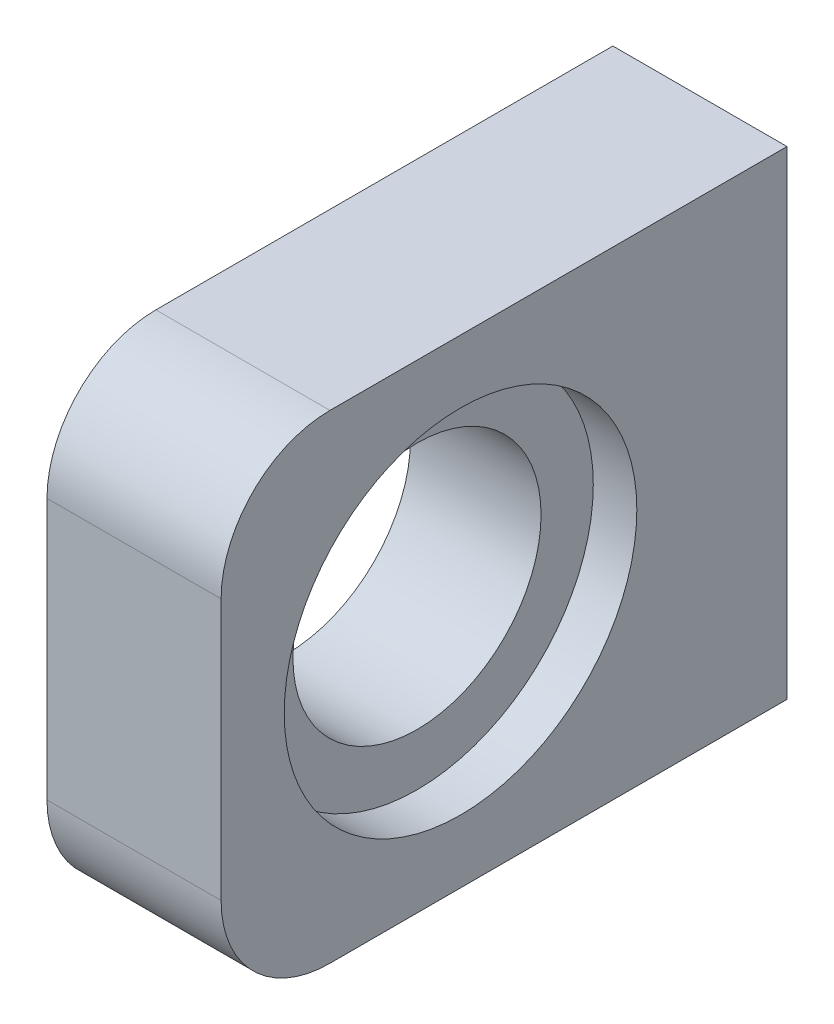
from build123d import *

# Parameters (mm, degrees)
SKETCH1_W                 = 26
SKETCH1_H                 = 22
BOSS_EXTRUDE1_DEPTH       = 8
SKETCH2_R                 = 8.1
CUT_EXTRUDE1_DEPTH        = 2
M4X0_7_TAPPED_HOLE1_D     = 3.3
M4X0_7_TAPPED_HOLE1_DEPTH = 6
M4X0_7_TAPPED_HOLE1_TIP   = 0.991420021
M10_CLEARANCE_HOLE1_D     = 11.4
FILLET1_R                 = 5


with BuildPart() as part:
    # Sketch1 → Boss-Extrude1 (new body)
    with BuildSketch(Plane(origin=(8, 0, 0), x_dir=(0, 0, -1), z_dir=(1, 0, 0))):
        with Locations((-9, 11)):
            Rectangle(SKETCH1_W, SKETCH1_H)
    extrude(amount=-BOSS_EXTRUDE1_DEPTH)

    # Sketch2 → Cut-Extrude1 (cut)
    with BuildSketch(Plane(origin=(8, 0, 0), x_dir=(0, 0, -1), z_dir=(1, 0, 0))):
        with Locations((-11, 11)):
            Circle(SKETCH2_R)
    extrude(amount=-CUT_EXTRUDE1_DEPTH, mode=Mode.SUBTRACT)

    # M4x0.7 Tapped Hole1
    with Locations(Plane(origin=(0, 0, -4), x_dir=(-1, 0, 0), z_dir=(0, 0, -1))):
        with Locations((-4, 16), (-4, 6)):
            Hole(M4X0_7_TAPPED_HOLE1_D / 2, depth=M4X0_7_TAPPED_HOLE1_DEPTH)
            with Locations((0, 0, -(M4X0_7_TAPPED_HOLE1_DEPTH + M4X0_7_TAPPED_HOLE1_TIP / 2))):  # 118° drill point
                Cone(0, M4X0_7_TAPPED_HOLE1_D / 2, M4X0_7_TAPPED_HOLE1_TIP, mode=Mode.SUBTRACT)

    # M10 Clearance Hole1 (through all)
    with Locations(Plane(origin=(6, 0, 0), x_dir=(0, 0, -1), z_dir=(1, 0, 0))):
        with Locations((-11, 11)):
            Hole(M10_CLEARANCE_HOLE1_D / 2)

    # Fillet1
    fillet1_edges = [part.edges().sort_by_distance(p)[0] for p in [
        (4, 0, 22),
        (4, 22, 22),
    ]]
    fillet(fillet1_edges, radius=FILLET1_R)


solid = part.part
